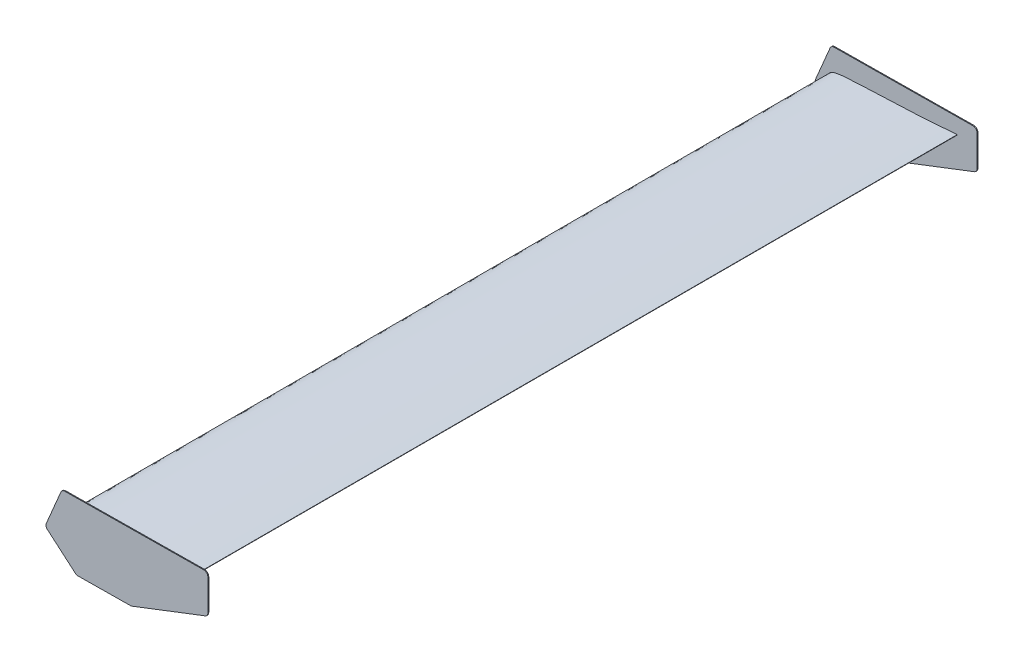
from build123d import *

# Parameters (mm, degrees)
REAR_WING_DEPTH              = 900
ENDPLATE_DEPTH               = 1
ENDPLATE_FILLET_R            = 10
ENDPLATE_FILLET_OF_MIRROR3_R = 10


with BuildPart() as part:
    # AirfoilSketch → Rear Wing (new, symmetric)
    with BuildSketch(Plane.XY):
        with BuildLine():
            Line((298.858661963, 26.146744918), (298.925633244, 25.369625335))
            add(Edge.make_bspline(
                [(298.925633244, 25.369625335), (294.065979012, 23.586076489), (284.370122598, 20.027585969), (264.903410228, 13.39903998), (240.497927233, 5.825631212), (211.041204877, -2.105196622), (181.52450249, -9.068903487), (151.88274102, -14.776173977), (122.142095145, -19.305545667), (97.17552492, -21.477023006), (77.120912857, -21.815841804), (61.992337864, -21.289429839), (46.757083853, -19.903409079), (34.045821936, -17.752947756), (23.801695789, -15.357547658), (16.024099458, -12.933014037), (9.32741176, -10.163184629), (3.420721634, -6.668683218), (-1.973772983, -0.694626299), (2.833098132, 4.643999656), (8.002521618, 7.022495107), (14.244268926, 8.865091961), (21.69082105, 10.17016836), (31.625594362, 11.495795313), (44.089703515, 12.53477522), (59.073726209, 13.404680396), (74.079791633, 13.895510536), (94.08632601, 14.680794893), (119.092912388, 15.631028881), (149.084537795, 17.084351573), (179.077245245, 18.412852934), (209.056880212, 19.92647278), (239.014705436, 21.72115857), (263.958755112, 23.471202745), (283.907703672, 24.927219473), (293.875098898, 25.740243753), (298.858661963, 26.146744918)],
                knots=[0, 0, 0, 0, 0.025304886, 0.050487653, 0.100520433, 0.150190716, 0.199586607, 0.248740009, 0.297715539, 0.346600594, 0.371102737, 0.395726297, 0.420570145, 0.445825119, 0.458702216, 0.471919982, 0.485786003, 0.493461051, 0.506863029, 0.51614777, 0.522766003, 0.535269014, 0.547551134, 0.559786371, 0.584228898, 0.60868081, 0.633151284, 0.657621757, 0.706558114, 0.75548187, 0.804405627, 0.853320224, 0.902221408, 0.951113136, 0.975557228, 1, 1, 1, 1], degree=3))
        make_face()
    extrude(amount=REAR_WING_DEPTH, both=True)

    # Endplate Sketch → Endplate (add, symmetric)
    with BuildSketch(Plane.XY.offset(900)):
        Polygon((4.198364617, 59.406656961), (-35.29092082, -33.850525596), (38.257501257, -96.733844985), (166.27509038, -95.421105135), (345.667321655, -26.31860721), (345.667321655, 62.908206322), align=None)
    endplate = extrude(amount=ENDPLATE_DEPTH, both=True)

    # Endplate Fillet
    endplate_fillet_edges = [part.edges().sort_by_distance(p)[0] for p in [
        (345.667321655, 62.908206322, 900),
        (4.198364617, 59.406656961, 900),
        (-35.29092082, -33.850525596, 900),
        (38.257501257, -96.733844985, 900),
        (166.27509038, -95.421105135, 900),
        (345.667321655, -26.31860721, 900),
    ]]
    fillet(endplate_fillet_edges, radius=ENDPLATE_FILLET_R)

    # Mirror3: Endplate across plane
    add(endplate.mirror(Plane.XY))

    # Endplate Fillet of Mirror3
    endplate_fillet_of_mirror3_edges = [part.edges().sort_by_distance(p)[0] for p in [
        (345.667321655, 62.908206322, -900),
        (4.198364617, 59.406656961, -900),
        (-35.29092082, -33.850525596, -900),
        (38.257501257, -96.733844985, -900),
        (166.27509038, -95.421105135, -900),
        (345.667321655, -26.31860721, -900),
    ]]
    fillet(endplate_fillet_of_mirror3_edges, radius=ENDPLATE_FILLET_OF_MIRROR3_R)


solid = part.part
